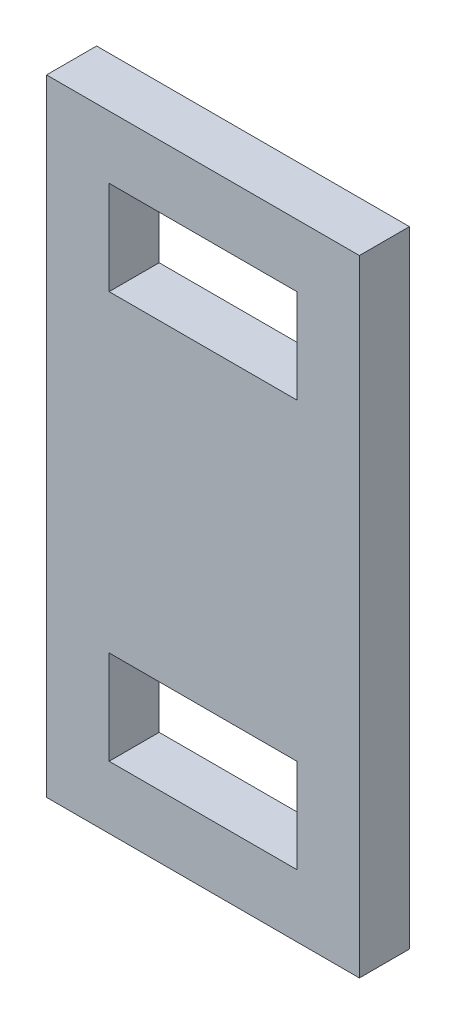
from build123d import *

# Parameters (mm, degrees)
ESQUISSE1_W        = 5
ESQUISSE1_H        = 10
ESQUISSE1_W_2      = 3
ESQUISSE1_H_2      = 1.5
BOSS_EXTRU_1_DEPTH = 0.8


with BuildPart() as part:
    # Esquisse1 → Boss.-Extru.1 (new body)
    with BuildSketch(Plane.XY):
        with Locations((2.5, -5)):
            Rectangle(ESQUISSE1_W, ESQUISSE1_H)
        with Locations((2.5, -8.25)):
            Rectangle(ESQUISSE1_W_2, ESQUISSE1_H_2, mode=Mode.SUBTRACT)
        with Locations((2.5, -1.75)):
            Rectangle(ESQUISSE1_W_2, ESQUISSE1_H_2, mode=Mode.SUBTRACT)
    extrude(amount=BOSS_EXTRU_1_DEPTH)


solid = part.part
